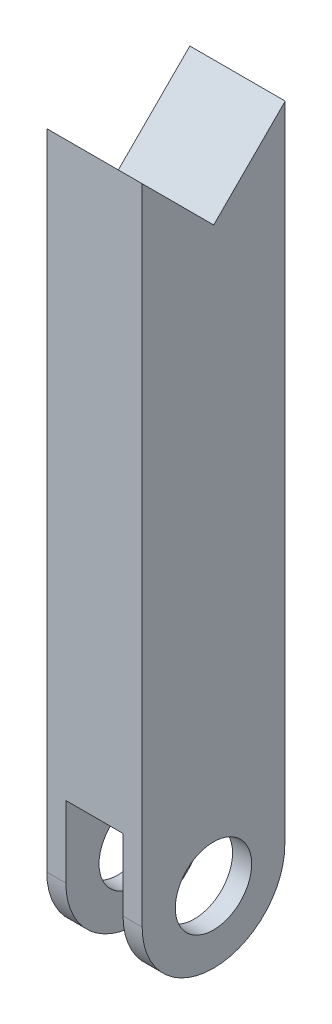
from build123d import *

# Parameters (mm, degrees)
BOSS_EXTRUDE1_DEPTH = 100
CUT_EXTRUDE2_DEPTH  = 20
CUT_EXTRUDE3_START  = -20
CUT_EXTRUDE3_DEPTH  = 20
SKETCH10_R          = 40
BOSS_EXTRUDE6_DEPTH = 20
BOSS_EXTRUDE7_START = 20
SKETCH11_R          = 40
BOSS_EXTRUDE7_DEPTH = 20
SKETCH19_R          = 40
CUT_EXTRUDE7_DEPTH  = 285
SKETCH16_W          = 60
SKETCH16_H          = 150
CUT_EXTRUDE8_DEPTH  = 285
SKETCH20_W          = 100
SKETCH20_H          = 295.959975124
CUT_EXTRUDE9_DEPTH  = 285
BOSS_EXTRUDE8_DEPTH = 100


with BuildPart() as part:
    # Sketch1 → Boss-Extrude1 (new body)
    with BuildSketch(Plane(origin=(0, 0, 0), x_dir=(0, 0, -1), z_dir=(1, 0, 0))):
        with BuildLine():
            Line((-74.767803634, 0), (-74.767803634, 600))
            ThreePointArc((-74.767803634, 600), (0, 674.767803634), (74.767803634, 600))
            Line((74.767803634, 600), (74.767803634, 0))
            ThreePointArc((74.767803634, 0), (0, -74.767803634), (-74.767803634, 0))
        make_face()
    extrude(amount=BOSS_EXTRUDE1_DEPTH)

    # Sketch8 → Cut-Extrude2 (cut)
    with BuildSketch(Plane.ZY):
        with BuildLine():
            Line((-74.767803634, 600), (-74.767803634, 525))
            Line((-74.767803634, 525), (74.767803634, 525))
            Line((74.767803634, 525), (74.767803634, 600))
            ThreePointArc((74.767803634, 600), (0, 674.767803634), (-74.767803634, 600))
        make_face()
    extrude(amount=-CUT_EXTRUDE2_DEPTH, mode=Mode.SUBTRACT)

    # Sketch7 → Cut-Extrude3 (cut)
    with BuildSketch(Plane(origin=(100, 0, 0), x_dir=(0, 0, -1), z_dir=(1, 0, 0)).offset(CUT_EXTRUDE3_START)):
        with BuildLine():
            Line((-74.767803634, 600), (-74.767803634, 525))
            Line((-74.767803634, 525), (74.767803634, 525))
            Line((74.767803634, 525), (74.767803634, 600))
            ThreePointArc((74.767803634, 600), (0, 674.767803634), (-74.767803634, 600))
        make_face()
    extrude(amount=CUT_EXTRUDE3_DEPTH, mode=Mode.SUBTRACT)

    # Sketch10 → Boss-Extrude6 (add)
    with BuildSketch(Plane(origin=(80, 0, 0), x_dir=(0, 0, -1), z_dir=(1, 0, 0))):
        with Locations(Location((0, 600, 0), (0, 0, 180))):
            Circle(SKETCH10_R)
    extrude(amount=BOSS_EXTRUDE6_DEPTH)

    # Sketch11 → Boss-Extrude7 (add)
    with BuildSketch(Plane.ZY.offset(-20).offset(BOSS_EXTRUDE7_START)):
        with Locations((0, 600)):
            Circle(SKETCH11_R)
    extrude(amount=-BOSS_EXTRUDE7_DEPTH)

    # Sketch19 → Cut-Extrude7 (cut)
    with BuildSketch(Plane.ZY):
        Circle(SKETCH19_R)
    extrude(amount=-CUT_EXTRUDE7_DEPTH, mode=Mode.SUBTRACT)

    # Sketch16 → Cut-Extrude8 (cut)
    with BuildSketch(Plane.XY.offset(74.767803634)):
        with Locations((50, 0)):
            Rectangle(SKETCH16_W, SKETCH16_H)
    extrude(amount=-CUT_EXTRUDE8_DEPTH, mode=Mode.SUBTRACT)

    # Sketch20 → Cut-Extrude9 (cut)
    with BuildSketch(Plane.XY.offset(74.767803634)):
        with Locations((50, 672.979987562)):
            Rectangle(SKETCH20_W, SKETCH20_H)
    extrude(amount=-CUT_EXTRUDE9_DEPTH, mode=Mode.SUBTRACT)

    # Sketch21 → Boss-Extrude8 (add)
    with BuildSketch(Plane(origin=(100, 0, 0), x_dir=(0, 0, -1), z_dir=(1, 0, 0))):
        Polygon((-74.767803634, 525), (-74.767803634, 675), (0.232196366, 600), (75.232196366, 675), (74.767803634, 525), align=None)
    extrude(amount=-BOSS_EXTRUDE8_DEPTH)


solid = part.part
